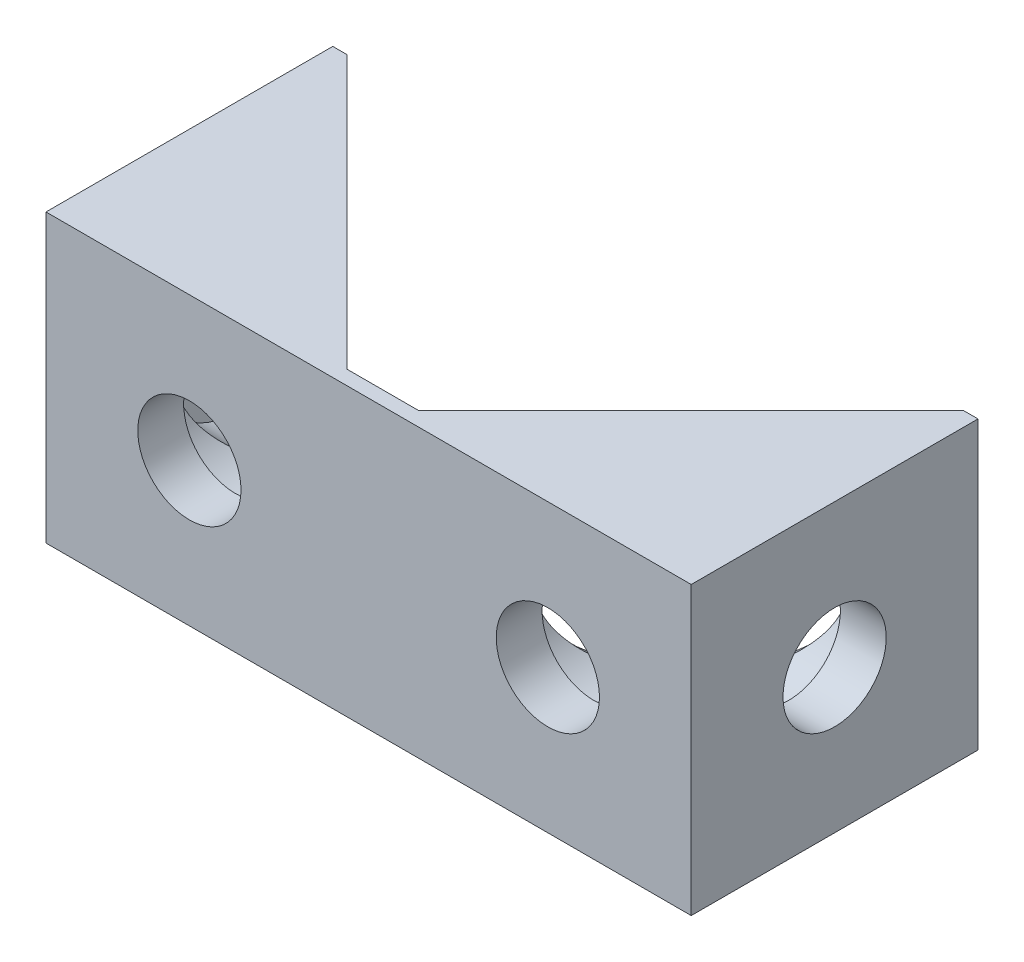
from build123d import *

# Parameters (mm, degrees)
BOSS_EXTRUDE1_DEPTH = 10
CUT_EXTRUDE1_REACH  = 52.249
SKETCH3_R           = 3.6
CUT_EXTRUDE3_REACH  = 55.449
CUT_EXTRUDE3_START  = -3.2
SKETCH3_4_R         = 5.5
SKETCH3_4_R_2       = 3.6
CUT_EXTRUDE2_REACH  = 52.249
SKETCH4_R           = 3.6
CUT_EXTRUDE4_START  = -3.2
SKETCH4_3_R         = 5.5
SKETCH4_3_R_2       = 3.6
CUT_EXTRUDE4_DEPTH  = 38.6


with BuildPart() as part:
    # Sketch2 → Boss-Extrude1 (new, symmetric)
    with BuildSketch(Plane(origin=(0, 0, 0), x_dir=(1, 0, 0), z_dir=(0, 1, 0))):
        Polygon((0, 0), (0, 20), (1, 20), (20, 1), (25, 1), (44, 20), (45, 20), (45, 0), (25, 0), (20, 0), align=None)
    extrude(amount=BOSS_EXTRUDE1_DEPTH, both=True)

    # Cut-Extrude1: up to this face of the body (flat: up to its plane)
    cut_extrude1_end = Plane(part.part.faces().sort_by_distance((0.5, 0, -20))[0])
    # Sketch3 → Cut-Extrude1 (cut, up to the picked face)
    with BuildSketch(Plane.XY, mode=Mode.PRIVATE) as cut_extrude1_sk1:
        with Locations((10, 0)):
            Circle(SKETCH3_R)
    cut_extrude1_tool1 = split(extrude(cut_extrude1_sk1.sketch, amount=-CUT_EXTRUDE1_REACH, mode=Mode.PRIVATE), bisect_by=cut_extrude1_end, keep=Keep.BOTH, mode=Mode.PRIVATE)
    # Sketch3 → Cut-Extrude1 (cut, up to the picked face)
    with BuildSketch(Plane.XY, mode=Mode.PRIVATE) as cut_extrude1_sk2:
        with Locations(Location((35, 0, 0), (0, 0, 180))):
            Circle(SKETCH3_R)
    cut_extrude1_tool2 = split(extrude(cut_extrude1_sk2.sketch, amount=-CUT_EXTRUDE1_REACH, mode=Mode.PRIVATE), bisect_by=cut_extrude1_end, keep=Keep.BOTH, mode=Mode.PRIVATE)
    add(cut_extrude1_tool1.solids().sort_by(Axis((10, 0, 0), (0, 0, -1)))[0], mode=Mode.SUBTRACT)
    add(cut_extrude1_tool2.solids().sort_by(Axis((35, 0, 0), (0, 0, -1)))[0], mode=Mode.SUBTRACT)

    # Cut-Extrude3: up to this face of the body (flat: up to its plane)
    cut_extrude3_end = Plane(part.part.faces().sort_by_distance((0.5, 0, -20))[0])
    # Sketch3<4> → Cut-Extrude3 (cut, up to the picked face)
    with BuildSketch(Plane.XY.offset(CUT_EXTRUDE3_START), mode=Mode.PRIVATE) as cut_extrude3_sk1:
        with Locations((10, 0)):
            Circle(SKETCH3_4_R)
        with Locations((10, 0)):
            Circle(SKETCH3_4_R_2, mode=Mode.SUBTRACT)
    cut_extrude3_tool1 = split(extrude(cut_extrude3_sk1.sketch, amount=-CUT_EXTRUDE3_REACH, mode=Mode.PRIVATE), bisect_by=cut_extrude3_end, keep=Keep.BOTH, mode=Mode.PRIVATE)
    # Sketch3<4> → Cut-Extrude3 (cut, up to the picked face)
    with BuildSketch(Plane.XY.offset(CUT_EXTRUDE3_START), mode=Mode.PRIVATE) as cut_extrude3_sk2:
        with Locations(Location((35, 0, 0), (0, 0, 180))):
            Circle(SKETCH3_4_R)
        with Locations((35, 0)):
            Circle(SKETCH3_4_R_2, mode=Mode.SUBTRACT)
    cut_extrude3_tool2 = split(extrude(cut_extrude3_sk2.sketch, amount=-CUT_EXTRUDE3_REACH, mode=Mode.PRIVATE), bisect_by=cut_extrude3_end, keep=Keep.BOTH, mode=Mode.PRIVATE)
    add(cut_extrude3_tool1.solids().sort_by(Axis((4.655563, 0, -3.2), (0, 0, -1)))[0], mode=Mode.SUBTRACT)
    add(cut_extrude3_tool2.solids().sort_by(Axis((40.344437, 0, -3.2), (0, 0, -1)))[0], mode=Mode.SUBTRACT)

    # Cut-Extrude2: up to this face of the body (flat: up to its plane)
    cut_extrude2_end = Plane(part.part.faces().sort_by_distance((45, 0, -10))[0])
    # Sketch4 → Cut-Extrude2 (cut, up to the picked face)
    with BuildSketch(Plane.ZY, mode=Mode.PRIVATE) as cut_extrude2_sk1:
        with Locations((-10, 0)):
            Circle(SKETCH4_R)
    cut_extrude2_tool1 = split(extrude(cut_extrude2_sk1.sketch, amount=-CUT_EXTRUDE2_REACH, mode=Mode.PRIVATE), bisect_by=cut_extrude2_end, keep=Keep.BOTH, mode=Mode.PRIVATE)
    add(cut_extrude2_tool1.solids().sort_by(Axis((0, 0, -10), (1, 0, 0)))[0], mode=Mode.SUBTRACT)

    # Sketch4<3> → Cut-Extrude4 (cut)
    with BuildSketch(Plane.ZY.offset(CUT_EXTRUDE4_START)):
        with Locations((-10, 0)):
            Circle(SKETCH4_3_R)
        with Locations((-10, 0)):
            Circle(SKETCH4_3_R_2, mode=Mode.SUBTRACT)
    extrude(amount=-CUT_EXTRUDE4_DEPTH, mode=Mode.SUBTRACT)


solid = part.part
